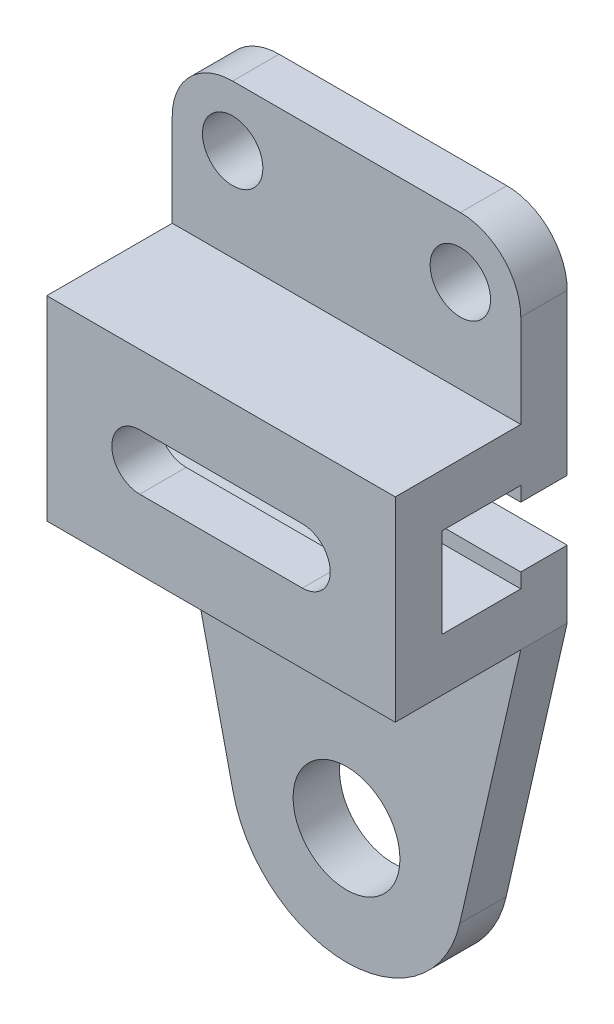
from build123d import *

# Parameters (mm, degrees)
BOSS_EXTRUDE1_DEPTH     = 37.5
CUT_EXTRUDE1_DEPTH      = 107.548111199
CUT_EXTRUDE1_DEPTH_BACK = 107.548111199
SKETCH2_R               = 11.5
SKETCH2_R_2             = 6.5


with BuildPart() as part:
    # Sketch1 → Boss-Extrude1 (new, symmetric)
    with BuildSketch(Plane(origin=(0, 0, 0), x_dir=(0, 0, -1), z_dir=(1, 0, 0))):
        Polygon((8.5, 21), (8.5, 54), (18.5, 54), (18.5, 21), (18.5, 6.5), (8.5, 6.5), (8.5, 9.648648649), (-8.5, 9.648648649), (-8.5, -9.648648649), (8.5, -9.648648649), (8.5, -6.5), (18.5, -6.5), (18.5, -21), (18.5, -98), (8.5, -98), (8.5, -21), (-18.5, -21), (-18.5, 21), align=None)
    extrude(amount=BOSS_EXTRUDE1_DEPTH, both=True)

    # Sketch2 → Cut-Extrude1 (cut, two sides: drawn at the far end of the back side and taken through both)
    with BuildSketch(Plane.XY.offset(-CUT_EXTRUDE1_DEPTH_BACK)):
        with BuildLine():
            Line((37.5, -98), (37.5, -21))
            Line((37.5, -21), (24.374261359, -78.558361557))
            ThreePointArc((24.374261359, -78.558361557), (15.589114141, -92.544296362), (-6.8e-08, -98))
            Line((-6.8e-08, -98), (37.5, -98))
        make_face()
        with Locations((0, -73)):
            Circle(SKETCH2_R)
        with BuildLine():
            Line((-37.5, -98), (-6.8e-08, -98))
            ThreePointArc((-6.8e-08, -98), (-15.589114194, -92.54429632), (-24.374261359, -78.558361557))
            Line((-24.374261359, -78.558361557), (-37.5, -21))
            Line((-37.5, -21), (-37.5, -98))
        make_face()
        with BuildLine():
            Line((-17.5, -6), (17.5, -6))
            ThreePointArc((17.5, -6), (23.5, 0), (17.5, 6))
            Line((17.5, 6), (-17.5, 6))
            ThreePointArc((-17.5, 6), (-23.5, 0), (-17.5, -6))
        make_face()
        with Locations((24.5, 41)):
            Circle(SKETCH2_R_2)
        with Locations((-24.5, 41)):
            Circle(SKETCH2_R_2)
        with BuildLine():
            Line((37.5, 54), (24.5, 54))
            ThreePointArc((24.5, 54), (33.692388155, 50.192388155), (37.5, 41))
            Line((37.5, 41), (37.5, 54))
        make_face()
        with BuildLine():
            Line((-37.5, 54), (-37.5, 41))
            ThreePointArc((-37.5, 41), (-33.692388155, 50.192388155), (-24.5, 54))
            Line((-24.5, 54), (-37.5, 54))
        make_face()
    extrude(amount=CUT_EXTRUDE1_DEPTH + CUT_EXTRUDE1_DEPTH_BACK, mode=Mode.SUBTRACT)


solid = part.part
